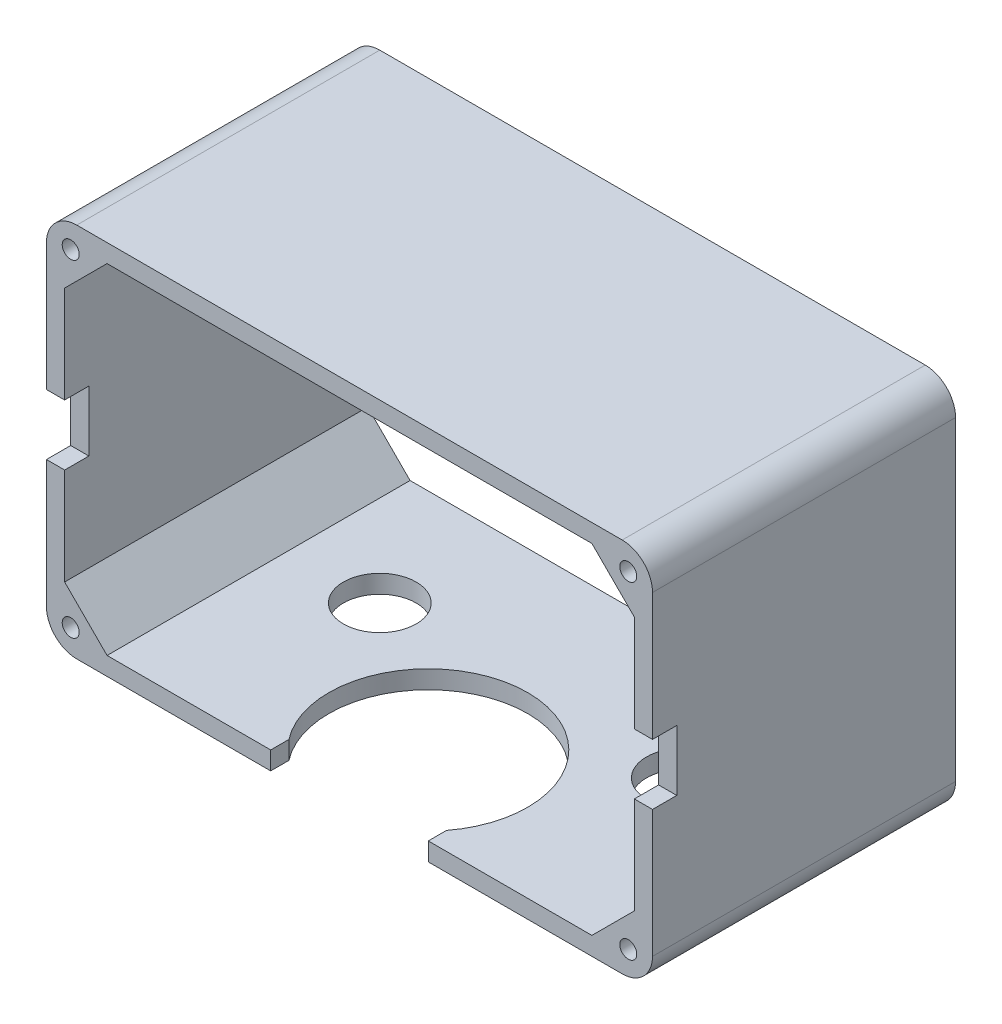
from build123d import *

# Parameters (mm, degrees)
EXTRUDE_1_DEPTH          = 50
EXTRUDE_2_DEPTH          = 50
SKETCH_4_R               = 1.4
CUT_EXTRUDE_1_DEPTH      = 60
MIRROR_2_COPY_1_DEPTH    = 50
MIRROR_2_COPY_2_SKETCH_R = 1.4
MIRROR_2_COPY_2_DEPTH    = 60
CUT_EXTRUDE_2_DEPTH      = 10
SKETCH_7_R               = 6
CUT_EXTRUDE_3_DEPTH      = 10
SKETCH_8_W               = 4
SKETCH_8_H               = 10
CUT_EXTRUDE_4_DEPTH      = 100


with BuildPart() as part:
    # 草图1 → 凸台-拉伸1 (new body)
    with BuildSketch(Plane.XY):
        with BuildLine():
            Line((-45, 31), (45, 31))
            ThreePointArc((45, 31), (48.535533906, 29.535533906), (50, 26))
            Line((50, 26), (50, -26))
            ThreePointArc((50, -26), (48.535533906, -29.535533906), (45, -31))
            Line((45, -31), (-45, -31))
            ThreePointArc((-45, -31), (-48.535533906, -29.535533906), (-50, -26))
            Line((-50, -26), (-50, 26))
            ThreePointArc((-50, 26), (-48.535533906, 29.535533906), (-45, 31))
        make_face()
        with BuildLine():
            Line((-42, 28), (42, 28))
            ThreePointArc((42, 28), (45.535533906, 26.535533906), (47, 23))
            Line((47, 23), (47, -23))
            ThreePointArc((47, -23), (45.535533906, -26.535533906), (42, -28))
            Line((42, -28), (-42, -28))
            ThreePointArc((-42, -28), (-45.535533906, -26.535533906), (-47, -23))
            Line((-47, -23), (-47, 23))
            ThreePointArc((-47, 23), (-45.535533906, 26.535533906), (-42, 28))
        make_face(mode=Mode.SUBTRACT)
    extrude(amount=EXTRUDE_1_DEPTH)

    # 草图3 → 凸台-拉伸2 (add)
    with BuildSketch(Plane.XY.offset(50)):
        Polygon((-47, 28), (-47, 21), (-40, 28), align=None)
    extrude_2 = extrude(amount=-EXTRUDE_2_DEPTH)

    # 草图4 → 切除-拉伸1 (cut)
    with BuildSketch(Plane.XY.offset(50)):
        with Locations((-46, 27)):
            Circle(SKETCH_4_R)
    cut_extrude_1 = extrude(amount=-CUT_EXTRUDE_1_DEPTH, mode=Mode.SUBTRACT)

    # 镜向1: 凸台-拉伸2, 切除-拉伸1 across plane
    add(extrude_2.mirror(Plane(origin=(0, 0, 0), x_dir=(0, 0, 1), z_dir=(1, 0, 0))))
    add(cut_extrude_1.mirror(Plane(origin=(0, 0, 0), x_dir=(0, 0, 1), z_dir=(1, 0, 0))), mode=Mode.SUBTRACT)

    # 镜向2: 凸台-拉伸2, 切除-拉伸1 across plane
    add(extrude_2.mirror(Plane.ZX))
    add(cut_extrude_1.mirror(Plane.ZX), mode=Mode.SUBTRACT)

    # 镜向2 copy 1 sketch → 镜向2 copy 1 (add)
    with BuildSketch(Plane(origin=(0, 0, 50), x_dir=(-1, 0, 0), z_dir=(0, 0, 1))):
        Polygon((-47, 28), (-47, 21), (-40, 28), align=None)
    extrude(amount=-MIRROR_2_COPY_1_DEPTH)

    # 镜向2 copy 2 sketch → 镜向2 copy 2 (cut)
    with BuildSketch(Plane(origin=(0, 0, 50), x_dir=(-1, 0, 0), z_dir=(0, 0, 1))):
        with Locations((-46, 27)):
            Circle(MIRROR_2_COPY_2_SKETCH_R)
    extrude(amount=-MIRROR_2_COPY_2_DEPTH, mode=Mode.SUBTRACT)

    # 草图6 → 切除-拉伸2 (cut)
    with BuildSketch(Plane.XZ.offset(31)):
        with BuildLine():
            Line((-13, 50), (13, 50))
            Line((13, 50), (13, 47))
            ThreePointArc((13, 47), (0, 20.598780533), (-13, 47))
            Line((-13, 47), (-13, 50))
        make_face()
    extrude(amount=-CUT_EXTRUDE_2_DEPTH, mode=Mode.SUBTRACT)

    # 草图7 → 切除-拉伸3 (cut)
    with BuildSketch(Plane.XZ.offset(31)):
        with Locations(Location((-25, 20, 0), (0, 0, 270))):
            Circle(SKETCH_7_R)
        with Locations(Location((25, 20, 0), (0, 0, 270))):
            Circle(SKETCH_7_R)
    extrude(amount=-CUT_EXTRUDE_3_DEPTH, mode=Mode.SUBTRACT)

    # 草图8 → 切除-拉伸4 (cut)
    with BuildSketch(Plane(origin=(50, 0, 0), x_dir=(0, 0, -1), z_dir=(1, 0, 0))):
        with Locations((-48, 0)):
            Rectangle(SKETCH_8_W, SKETCH_8_H)
    extrude(amount=-CUT_EXTRUDE_4_DEPTH, mode=Mode.SUBTRACT)


solid = part.part
